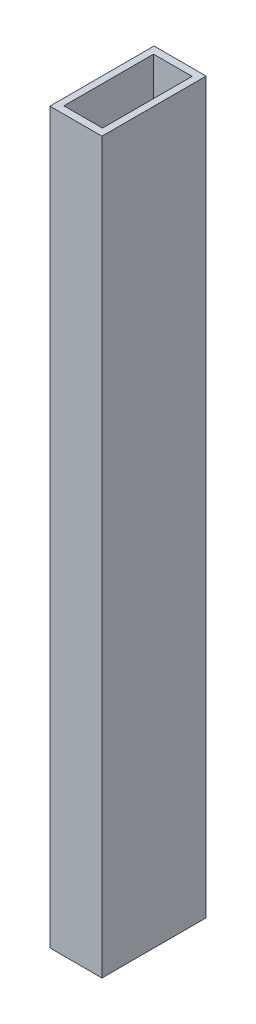
from build123d import *

# Parameters (mm, degrees)
SKETCH1_W           = 12.7
SKETCH1_H           = 25.4
SKETCH1_W_2         = 9.398
SKETCH1_H_2         = 21.844
BOSS_EXTRUDE1_DEPTH = 177.8


with BuildPart() as part:
    # Sketch1 → Boss-Extrude1 (new body)
    with BuildSketch(Plane(origin=(0, 0, 0), x_dir=(1, 0, 0), z_dir=(0, 1, 0))):
        with Locations((6.35, 12.7)):
            Rectangle(SKETCH1_W, SKETCH1_H)
        with Locations((6.35, 12.7)):
            Rectangle(SKETCH1_W_2, SKETCH1_H_2, mode=Mode.SUBTRACT)
    extrude(amount=BOSS_EXTRUDE1_DEPTH)


solid = part.part
